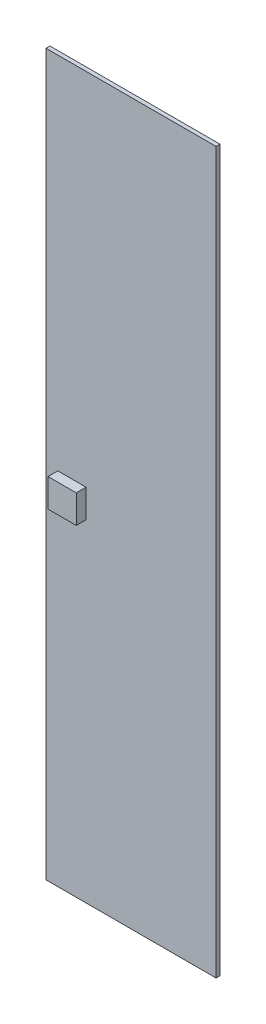
from build123d import *

# Parameters (mm, degrees)
ESQUISSE1_W             = 433.5
ESQUISSE1_H             = 1837
BOSS_EXTRU_1_DEPTH      = 10
BOSS_EXTRU_2_DEPTH      = 25
BOSS_EXTRU_2_DEPTH_BACK = 40
ESQUISSE2_W             = 72
ESQUISSE2_H             = 72


with BuildPart() as part:
    # Esquisse1 → Boss.-Extru.1 (new body)
    with BuildSketch(Plane.XY):
        Rectangle(ESQUISSE1_W, ESQUISSE1_H)
    extrude(amount=BOSS_EXTRU_1_DEPTH)

    # Esquisse2 → Boss.-Extru.2 (add, two sides: drawn at the far end of the back side and taken through both)
    with BuildSketch(Plane.XY.offset(10).offset(-BOSS_EXTRU_2_DEPTH_BACK)):
        with Locations((-150.75, -36)):
            Rectangle(ESQUISSE2_W, ESQUISSE2_H)
    extrude(amount=BOSS_EXTRU_2_DEPTH + BOSS_EXTRU_2_DEPTH_BACK)


solid = part.part
